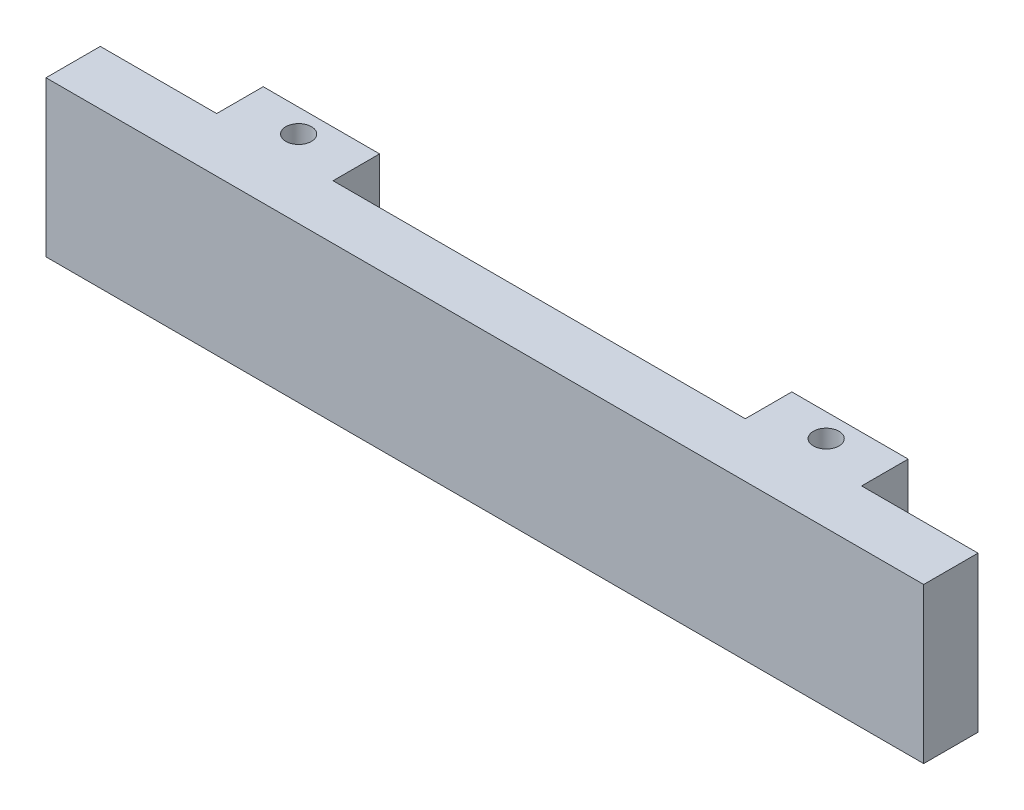
from build123d import *

# Parameters (mm, degrees)
SKETCH_1_W         = 7
SKETCH_1_H         = 20
EXTRUDE_1_DEPTH    = 56.57
SKETCH_2_W         = 15
SKETCH_2_H         = 12
EXTRUDE_2_DEPTH    = 6
HOLE_WIZARD_M4_1_D = 3.3


with BuildPart() as part:
    # 草图1 → 凸台-拉伸1 (new, symmetric)
    with BuildSketch(Plane(origin=(0, 0, 0), x_dir=(0, 0, -1), z_dir=(1, 0, 0))):
        Rectangle(SKETCH_1_W, SKETCH_1_H)
    extrude(amount=EXTRUDE_1_DEPTH, both=True)

    # 草图2 → 凸台-拉伸2 (add)
    with BuildSketch(Plane(origin=(0, 0, -3.5), x_dir=(-1, 0, 0), z_dir=(0, 0, -1))):
        with Locations((-34.07, 4)):
            Rectangle(SKETCH_2_W, SKETCH_2_H)
    extrude_2 = extrude(amount=EXTRUDE_2_DEPTH)

    # 镜向1: 凸台-拉伸2 across plane
    add(extrude_2.mirror(Plane(origin=(0, 0, 0), x_dir=(0, 0, 1), z_dir=(1, 0, 0))))

    # M4 螺纹孔1 (through all)
    with Locations(Plane(origin=(0, -2, 0), x_dir=(-1, 0, 0), z_dir=(0, -1, 0))):
        with Locations((34, 6.5), (-34, 6.5)):
            Hole(HOLE_WIZARD_M4_1_D / 2)


solid = part.part
